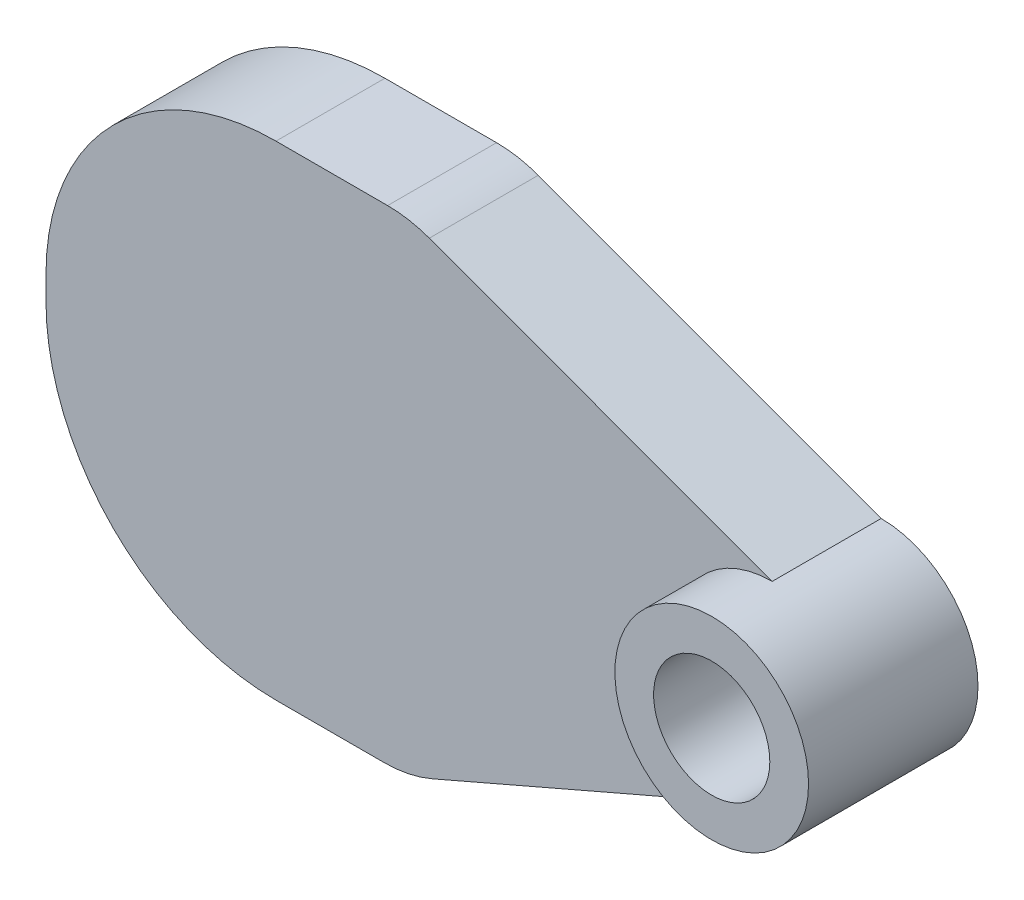
from build123d import *

# Parameters (mm, degrees)
RESSALTO_EXTRUS_O1_DEPTH = 4.5
ESBO_O3_R                = 4
RESSALTO_EXTRUS_O2_DEPTH = 2.5
ESBO_O5_R                = 2.4
CORTE_EXTRUS_O1_DEPTH    = 3.5


with BuildPart() as part:
    # Esboço1 → Ressalto-extrusão1 (new body)
    with BuildSketch(Plane.XY):
        with BuildLine():
            ThreePointArc((-5, -0.5), (-2.217514421, -7.217514421), (4.5, -10))
            Line((4.5, -10), (8.963244058, -10))
            ThreePointArc((8.963244058, -10), (9.978406451, -9.895860018), (10.951281246, -9.587778127))
            Line((10.951281246, -9.587778127), (25, -3.5))
            ThreePointArc((25, -3.5), (29, 0.5), (25, 4.5))
            Line((25, 4.5), (10.833504783, 9.694381579))
            ThreePointArc((10.833504783, 9.694381579), (9.986328816, 9.923002534), (9.112231538, 10))
            Line((9.112231538, 10), (4.5, 10))
            ThreePointArc((4.5, 10), (-2.217514421, 7.217514421), (-5, 0.5))
            Line((-5, 0.5), (-5, -0.5))
        make_face()
    extrude(amount=RESSALTO_EXTRUS_O1_DEPTH)

    # Esboço3 → Ressalto-extrusão2 (add)
    with BuildSketch(Plane.XY.offset(4.5)):
        with Locations((25, 0.5)):
            Circle(ESBO_O3_R)
    extrude(amount=RESSALTO_EXTRUS_O2_DEPTH)

    # Esboço5 → Corte-extrusão1 (cut)
    with BuildSketch(Plane.XY.offset(7)):
        with Locations((25, 0.5)):
            Circle(ESBO_O5_R)
    extrude(amount=-CORTE_EXTRUS_O1_DEPTH, mode=Mode.SUBTRACT)


solid = part.part
